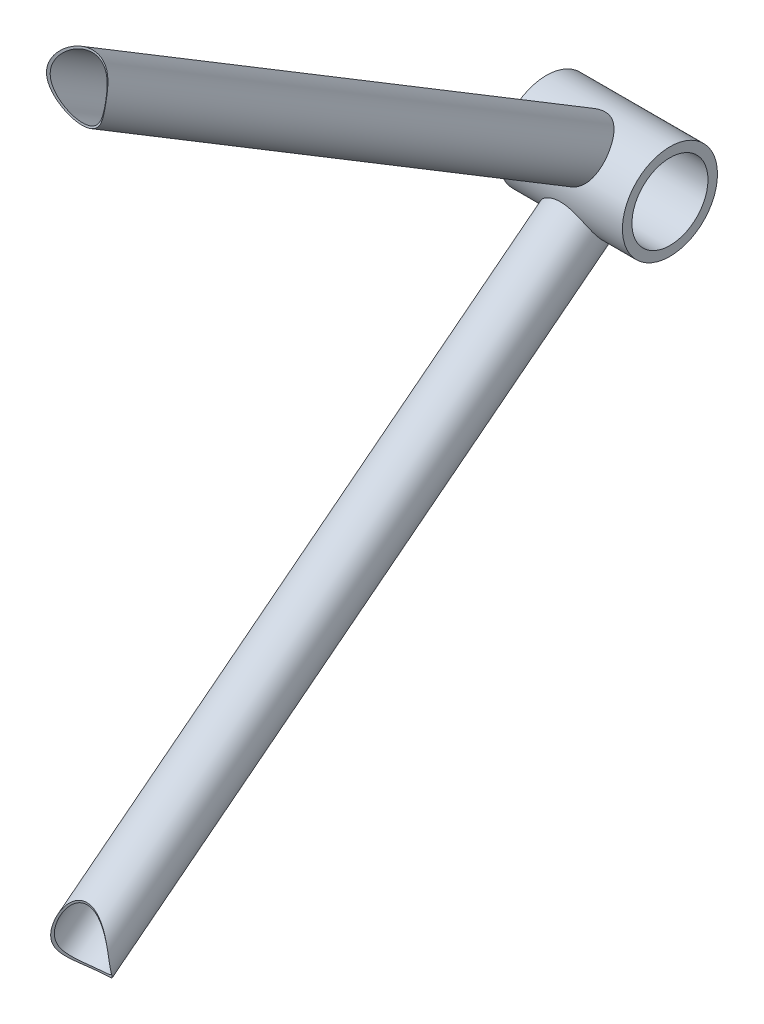
from build123d import *

# Parameters (mm, degrees)
BOSS_EXTRUDE1_DEPTH      = 20.6375
BOSS_EXTRUDE1_DEPTH_BACK = 20.6375
SKETCH1_R                = 15.875
SKETCH1_R_2              = 12.7
BOSS_EXTRUDE3_REACH      = 263.213
BOSS_EXTRUDE3_END_RADIUS = 15.875
SKETCH5_R                = 9.525
SKETCH5_R_2              = 8.89
BOSS_EXTRUDE2_REACH      = 346.916
BOSS_EXTRUDE2_END_RADIUS = 15.875
SKETCH4_R                = 9.525
SKETCH4_R_2              = 8.89
SKETCH13_R               = 12.7


with BuildPart() as part:
    # Sketch1 → Boss-Extrude1 (new, two sides: drawn at the far end of the back side and taken through both)
    with BuildSketch(Plane(origin=(0, 0, 0), x_dir=(0, 0, -1), z_dir=(1, 0, 0)).offset(-BOSS_EXTRUDE1_DEPTH_BACK)):
        Circle(SKETCH1_R)
        Circle(SKETCH1_R_2, mode=Mode.SUBTRACT)
    extrude(amount=BOSS_EXTRUDE1_DEPTH + BOSS_EXTRUDE1_DEPTH_BACK)


with BuildPart() as body_2:
    # Boss-Extrude3: up to this cylinder (the profile starts outside it)
    boss_extrude3_end = Plane(origin=(4.191496, 0, 0), z_dir=(1, 0, 0)) * Cylinder(BOSS_EXTRUDE3_END_RADIUS, 559.176, mode=Mode.PRIVATE)
    # Sketch5 → Boss-Extrude3 (new, up to the surface)
    with BuildSketch(Plane(origin=(13.430426637, 129.680735262, 198.333490367), x_dir=(0.9981998705093698, -0.0321242199519742, -0.05064635236179303), z_dir=(0.059975127583038426, 0.5339450472183996, 0.8433893944213071)), mode=Mode.PRIVATE) as boss_extrude3_sk1:
        Circle(SKETCH5_R)
        Circle(SKETCH5_R_2, mode=Mode.SUBTRACT)
    boss_extrude3_tool1 = extrude(boss_extrude3_sk1.sketch, amount=-BOSS_EXTRUDE3_REACH, mode=Mode.PRIVATE) - boss_extrude3_end
    add(boss_extrude3_tool1.solids().sort_by_distance((4.191496, 129.978064, 198.802252))[0])


with BuildPart() as body_3:
    # Boss-Extrude2: up to this cylinder (the profile starts outside it)
    boss_extrude2_end = Plane(origin=(4.617488, 0, 0), z_dir=(1, 0, 0)) * Cylinder(BOSS_EXTRUDE2_END_RADIUS, 726.582, mode=Mode.PRIVATE)
    # Sketch4 → Boss-Extrude2 (new, up to the surface)
    with BuildSketch(Plane(origin=(13.854330205, -131.227315899, 197.284292217), x_dir=(0.9979742198540056, 0.03453869256304647, -0.05342785062890198), z_dir=(0.06361958969409028, -0.5409266161491856, 0.8386602075623639)), mode=Mode.PRIVATE) as boss_extrude2_sk1:
        Circle(SKETCH4_R)
        Circle(SKETCH4_R_2, mode=Mode.SUBTRACT)
    boss_extrude2_tool1 = extrude(boss_extrude2_sk1.sketch, amount=-BOSS_EXTRUDE2_REACH, mode=Mode.PRIVATE) - boss_extrude2_end
    add(boss_extrude2_tool1.solids().sort_by_distance((4.617488, -131.546992, 197.778799))[0])


with BuildPart() as cut_sweep4_tool:
    # Cut-Sweep4: sweep along a path in FRH
    with BuildLine(Plane(origin=(-218.965343182, 0, 773.533205035), x_dir=(-0.3746065934159059, 0, 0.92718385456679), z_dir=(-0.92718385456679, 0, -0.3746065934159059))) as cut_sweep4_path:
        ThreePointArc((-696.824125417, 212.650771438), (-647.952914491, 193.600771438), (-622.972204466, 147.478522099))
        Line((-622.972204466, 147.478522099), (-605.102710502, 25.124814599))
        ThreePointArc((-605.102710502, 25.124814599), (-603.502914491, 3.100771438), (-605.102710502, -18.923271722))
        Line((-605.102710502, -18.923271722), (-622.972204466, -141.276979223))
        ThreePointArc((-622.972204466, -141.276979223), (-647.952914491, -187.399228562), (-696.824125417, -206.449228562))
    # Sketch13 → Cut-Sweep4 (sweep)
    with BuildSketch(Plane(origin=(42.06956865, 212.650771438, 127.449126476), x_dir=(0.7803123863430683, -0.5469316613994696, 0.3032793060503835), z_dir=(-0.37452926772752637, -0.020317336522068737, 0.926992466772051))):
        Circle(SKETCH13_R)
    sweep(path=cut_sweep4_path.line)


with BuildPart() as body_2_1:
    add(body_2.part)

    # Cut-Sweep4: cut by cut_sweep4_tool
    add(cut_sweep4_tool.part, mode=Mode.SUBTRACT)


with BuildPart() as body_3_1:
    add(body_3.part)

    # Cut-Sweep4: cut by cut_sweep4_tool
    add(cut_sweep4_tool.part, mode=Mode.SUBTRACT)


solid = Compound([part.part, body_2_1.part, body_3_1.part])
